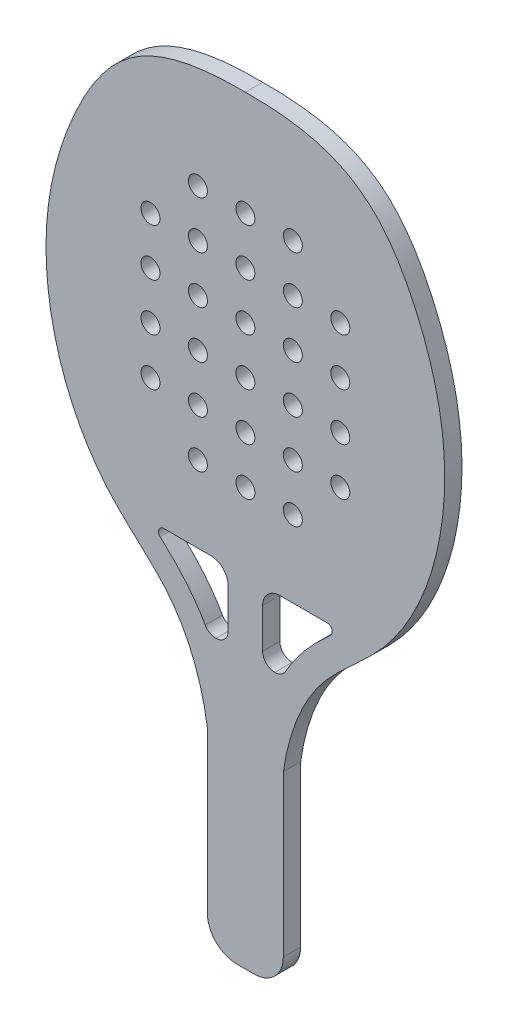
from build123d import *

# Parameters (mm, degrees)
SCHIZZO4_R                   = 5.5
ESTRUSIONE_ESTRUSIONE3_DEPTH = 10
RACCORDO3_R                  = 17
RACCORDO4_R                  = 3
RACCORDO5_R                  = 7


with BuildPart() as part:
    # Schizzo4 → Estrusione-Estrusione3 (new body)
    with BuildSketch(Plane.XY):
        with BuildLine():
            Line((-301.85080377, -365.337978803), (-279.85080377, -365.337978803))
            Line((-279.85080377, -365.337978803), (-257.85080377, -365.337978803))
            Line((-257.85080377, -365.337978803), (-257.85080377, -255.337978803))
            add(Edge.make_bspline(
                [(-279.85080377, 74.662021197), (-244.463064548, 74.984575014), (-208.012975737, 64.500528794), (-172.921242543, 3.126644824), (-155.794257428, -72.626959868), (-182.890785149, -156.449073323), (-242.517120863, -200.102433974), (-255.012715109, -235.596828616), (-257.85080377, -255.337978803)],
                knots=[0, 0, 0, 0, 0.150070551, 0.226928811, 0.372737193, 0.578941384, 0.665352937, 0.775034733, 0.775034733, 0.775034733, 0.775034733], degree=3))
            add(Edge.make_bspline(
                [(-279.85080377, 74.662021197), (-315.238542992, 74.984575014), (-351.688631803, 64.500528794), (-386.780364997, 3.126644824), (-403.907350111, -72.626959868), (-376.81082239, -156.449073323), (-317.184486676, -200.102433974), (-304.688892431, -235.596828616), (-301.85080377, -255.337978803)],
                knots=[0, 0, 0, 0, 0.150070551, 0.226928811, 0.372737193, 0.578941384, 0.665352937, 0.775034733, 0.775034733, 0.775034733, 0.775034733], degree=3))
            Line((-301.85080377, -255.337978803), (-301.85080377, -365.337978803))
        make_face()
        with BuildLine():
            add(Edge.make_bspline(
                [(-334.850568316, -167.916421674), (-332.212742465, -170.351196912), (-326.181603526, -175.840202357), (-319.106655667, -182.798443347), (-314.200907698, -188.410370573), (-310.989011306, -192.35221397), (-306.374662828, -198.734925607), (-303.046850668, -204.371734555), (-301.189958022, -207.91651557)],
                knots=[0.609470494, 0.609470494, 0.609470494, 0.609470494, 0.629715721, 0.653935556, 0.659990515, 0.666045474, 0.678155392, 0.697421151, 0.697421151, 0.697421151, 0.697421151], degree=3))
            Line((-334.850568316, -167.916421674), (-299.851183672, -167.916421674))
            ThreePointArc((-299.851183672, -167.916421674), (-292.78011586, -170.845353862), (-289.851183672, -177.916421674))
            Line((-289.851183672, -177.916421674), (-289.851183672, -207.91651557))
            Line((-289.851183672, -207.91651557), (-301.189958022, -207.91651557))
        make_face(mode=Mode.SUBTRACT)
        with BuildLine():
            Line((-258.511596707, -207.91651557), (-269.850423867, -207.91651557))
            Line((-269.850423867, -207.91651557), (-269.850423867, -177.916421674))
            ThreePointArc((-269.850423867, -177.916421674), (-266.921491679, -170.845353862), (-259.850423867, -167.916421674))
            Line((-259.850423867, -167.916421674), (-224.850603084, -167.916421674))
            add(Edge.make_bspline(
                [(-224.850603084, -167.916421674), (-227.488510386, -170.351251168), (-233.519749496, -175.840289589), (-240.594808933, -182.798574685), (-245.500579478, -188.410474331), (-248.712491912, -192.352299459), (-253.326860813, -198.734975954), (-256.654692578, -204.371755527), (-258.511596707, -207.91651557)],
                knots=[0.609469891, 0.609469891, 0.609469891, 0.609469891, 0.629715721, 0.653935556, 0.659990515, 0.666045474, 0.678155392, 0.697421102, 0.697421102, 0.697421102, 0.697421102], degree=3))
        make_face(mode=Mode.SUBTRACT)
        with Locations((-334.85080377, -96.130554038)):
            Circle(SCHIZZO4_R, mode=Mode.SUBTRACT)
        with Locations((-307.35080377, -123.630554038)):
            Circle(SCHIZZO4_R, mode=Mode.SUBTRACT)
        with Locations((-307.35080377, -96.130554038)):
            Circle(SCHIZZO4_R, mode=Mode.SUBTRACT)
        with Locations((-334.85080377, -68.630554038)):
            Circle(SCHIZZO4_R, mode=Mode.SUBTRACT)
        with Locations((-334.85080377, -41.130554038)):
            Circle(SCHIZZO4_R, mode=Mode.SUBTRACT)
        with Locations((-307.35080377, -68.630554038)):
            Circle(SCHIZZO4_R, mode=Mode.SUBTRACT)
        with Locations((-307.35080377, -41.130554038)):
            Circle(SCHIZZO4_R, mode=Mode.SUBTRACT)
        with Locations((-279.85080377, -41.130554038)):
            Circle(SCHIZZO4_R, mode=Mode.SUBTRACT)
        with Locations((-334.85080377, -13.630554038)):
            Circle(SCHIZZO4_R, mode=Mode.SUBTRACT)
        with Locations((-307.35080377, -13.630554038)):
            Circle(SCHIZZO4_R, mode=Mode.SUBTRACT)
        with Locations((-279.85080377, -13.630554038)):
            Circle(SCHIZZO4_R, mode=Mode.SUBTRACT)
        with Locations((-307.35080377, 13.869445962)):
            Circle(SCHIZZO4_R, mode=Mode.SUBTRACT)
        with Locations((-279.85080377, 13.869445962)):
            Circle(SCHIZZO4_R, mode=Mode.SUBTRACT)
        with Locations((-279.85080377, -123.630554038)):
            Circle(SCHIZZO4_R, mode=Mode.SUBTRACT)
        with Locations((-252.35080377, -123.630554038)):
            Circle(SCHIZZO4_R, mode=Mode.SUBTRACT)
        with Locations((-279.85080377, -96.130554038)):
            Circle(SCHIZZO4_R, mode=Mode.SUBTRACT)
        with Locations((-252.35080377, -96.130554038)):
            Circle(SCHIZZO4_R, mode=Mode.SUBTRACT)
        with Locations((-224.85080377, -96.130554038)):
            Circle(SCHIZZO4_R, mode=Mode.SUBTRACT)
        with Locations((-279.85080377, -68.630554038)):
            Circle(SCHIZZO4_R, mode=Mode.SUBTRACT)
        with Locations((-252.35080377, -68.630554038)):
            Circle(SCHIZZO4_R, mode=Mode.SUBTRACT)
        with Locations((-252.35080377, -41.130554038)):
            Circle(SCHIZZO4_R, mode=Mode.SUBTRACT)
        with Locations((-224.85080377, -68.630554038)):
            Circle(SCHIZZO4_R, mode=Mode.SUBTRACT)
        with Locations((-224.85080377, -41.130554038)):
            Circle(SCHIZZO4_R, mode=Mode.SUBTRACT)
        with Locations((-252.35080377, -13.630554038)):
            Circle(SCHIZZO4_R, mode=Mode.SUBTRACT)
        with Locations((-252.35080377, 13.869445962)):
            Circle(SCHIZZO4_R, mode=Mode.SUBTRACT)
        with Locations((-224.85080377, -13.630554038)):
            Circle(SCHIZZO4_R, mode=Mode.SUBTRACT)
    extrude(amount=ESTRUSIONE_ESTRUSIONE3_DEPTH)

    # Raccordo3
    raccordo3_edges = [part.edges().sort_by_distance(p)[0] for p in [
        (-257.85080377, -365.337978803, 5),
        (-301.85080377, -365.337978803, 5),
    ]]
    fillet(raccordo3_edges, radius=RACCORDO3_R)

    # Raccordo4
    raccordo4_edges = [part.edges().sort_by_distance(p)[0] for p in [
        (-334.850568316, -167.916421674, 5),
        (-224.850603084, -167.916421674, 5),
    ]]
    fillet(raccordo4_edges, radius=RACCORDO4_R)

    # Raccordo5
    raccordo5_edges = [part.edges().sort_by_distance(p)[0] for p in [
        (-269.850423867, -207.91651557, 5),
        (-258.511596707, -207.91651557, 5),
        (-301.189958022, -207.91651557, 5),
        (-289.851183672, -207.91651557, 5),
    ]]
    fillet(raccordo5_edges, radius=RACCORDO5_R)


solid = part.part
